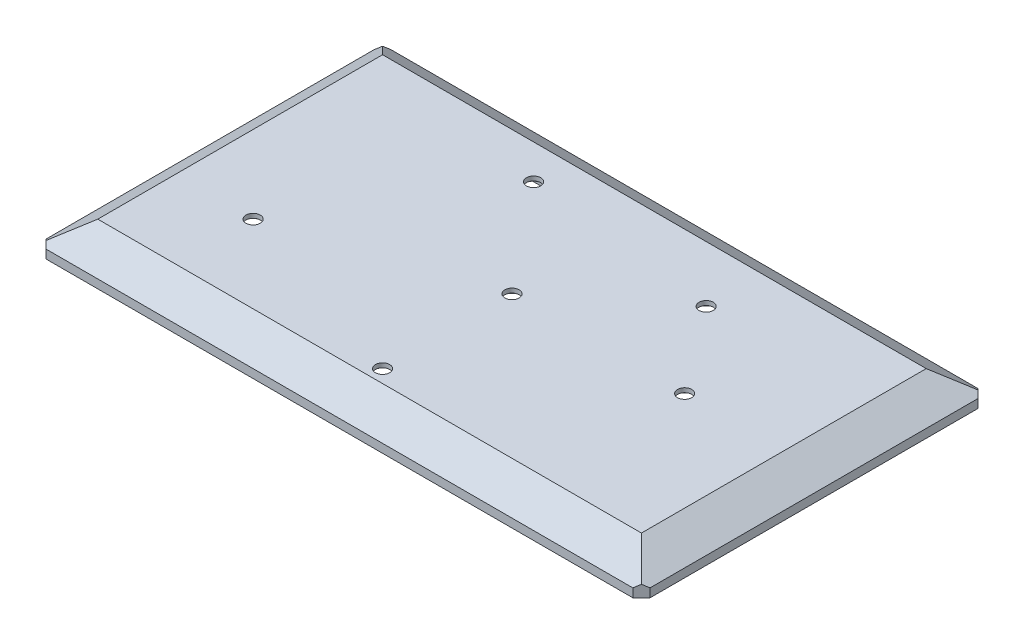
from build123d import *

# Parameters (mm, degrees)
SKETCH1_W               = 140
SKETCH1_H               = 80
BOSS_EXTRUDE1_DEPTH     = 2
CHAMFER2_SIZE           = 2
SKETCH4_W               = 8
SKETCH4_H               = 10
BOSS_EXTRUDE2_DEPTH     = 7
SKETCH5_R               = 2.05
CUT_EXTRUDE1_DEPTH      = 139.965499445
SKETCH6_W               = 107.8
SKETCH6_H               = 64
CUT_EXTRUDE2_DEPTH      = 5
SKETCH7_R               = 1.65
CUT_EXTRUDE3_DEPTH      = 82.510735624
CUT_EXTRUDE4_DEPTH      = 82.510735624
CUT_EXTRUDE4_DEPTH_BACK = 1
SKETCH8_R               = 3


with BuildPart() as part:
    # Sketch1 → Boss-Extrude1 (new body)
    with BuildSketch(Plane(origin=(0, 0, 0), x_dir=(1, 0, 0), z_dir=(0, 1, 0))):
        Rectangle(SKETCH1_W, SKETCH1_H)
    extrude(amount=BOSS_EXTRUDE1_DEPTH)

    # Sketch3 → Loft1 section 0
    with BuildSketch(Plane(origin=(0, 7, 0), x_dir=(1, 0, 0), z_dir=(0, 1, 0))):
        with BuildLine():
            Line((-63, -33), (63, -33))
            Line((63, -33), (63, 33))
            Line((63, 33), (-63, 33))
            Line((-63, 33), (-63, -33))
        make_face()
    # Sketch2 → Loft1 section 1
    with BuildSketch(Plane(origin=(0, 2, 0), x_dir=(1, 0, 0), z_dir=(0, 1, 0))):
        with BuildLine():
            Line((70, -40), (70, 40))
            Line((70, 40), (-70, 40))
            Line((-70, 40), (-70, -40))
            Line((-70, -40), (70, -40))
        make_face()
    loft()

    # Chamfer2
    chamfer2_edges = [part.edges().sort_by_distance(p)[0] for p in [
        (70, 1, 40),
        (-70, 1, 40),
        (-70, 1, -40),
        (70, 1, -40),
    ]]
    chamfer(chamfer2_edges, length=CHAMFER2_SIZE)

    # Sketch4 → Boss-Extrude2 (add)
    with BuildSketch(Plane.XZ):
        with Locations((-58.9, 20)):
            Rectangle(SKETCH4_W, SKETCH4_H)
        with Locations((-58.9, -20)):
            Rectangle(SKETCH4_W, SKETCH4_H)
        with Locations((58.9, -20)):
            Rectangle(SKETCH4_W, SKETCH4_H)
        with Locations((58.9, 20)):
            Rectangle(SKETCH4_W, SKETCH4_H)
    extrude(amount=BOSS_EXTRUDE2_DEPTH)

    # Sketch5 → Cut-Extrude1 (cut, through all)
    with BuildSketch(Plane.ZY.offset(62.9)):
        with Locations((-20, -3.5)):
            Circle(SKETCH5_R)
        with Locations((20, -3.5)):
            Circle(SKETCH5_R)
    extrude(amount=-CUT_EXTRUDE1_DEPTH, mode=Mode.SUBTRACT)

    # Sketch6 → Cut-Extrude2 (cut)
    with BuildSketch(Plane.XZ):
        Rectangle(SKETCH6_W, SKETCH6_H)
    extrude(amount=-CUT_EXTRUDE2_DEPTH, mode=Mode.SUBTRACT)

    # Sketch7 → Cut-Extrude3 (cut, through all)
    with BuildSketch(Plane.XZ.offset(-5)):
        with Locations(Location((0, 30, 0), (0, 0, 270))):
            Circle(SKETCH7_R)
        with Locations(Location((40, 0, 0), (0, 0, 270))):
            Circle(SKETCH7_R)
        with Locations(Location((25, -20, 0), (0, 0, 270))):
            Circle(SKETCH7_R)
        with Locations(Location((-20, -25, 0), (0, 0, 270))):
            Circle(SKETCH7_R)
        with Locations(Location((-45, 15, 0), (0, 0, 270))):
            Circle(SKETCH7_R)
        with Locations(Location((0, 0, 0), (0, 0, 270))):
            Circle(SKETCH7_R)
    extrude(amount=-CUT_EXTRUDE3_DEPTH, mode=Mode.SUBTRACT)

    # Sketch8 → Cut-Extrude4 (cut, two sides: drawn at the far end of the back side and taken through both)
    with BuildSketch(Plane.XZ.offset(-5).offset(-CUT_EXTRUDE4_DEPTH_BACK)):
        with Locations(Location((0, 30, 0), (0, 0, 41.810314896))):
            Circle(SKETCH8_R)
        with Locations(Location((40, 0, 0), (0, 0, 270))):
            Circle(SKETCH8_R)
        with Locations(Location((25, -20, 0), (0, 0, 270))):
            Circle(SKETCH8_R)
        with Locations(Location((0, 0, 0), (0, 0, 270))):
            Circle(SKETCH8_R)
        with Locations(Location((-45, 15, 0), (0, 0, 270))):
            Circle(SKETCH8_R)
        with Locations(Location((-20, -25, 0), (0, 0, 270))):
            Circle(SKETCH8_R)
    extrude(amount=CUT_EXTRUDE4_DEPTH + CUT_EXTRUDE4_DEPTH_BACK, mode=Mode.SUBTRACT)


solid = part.part
